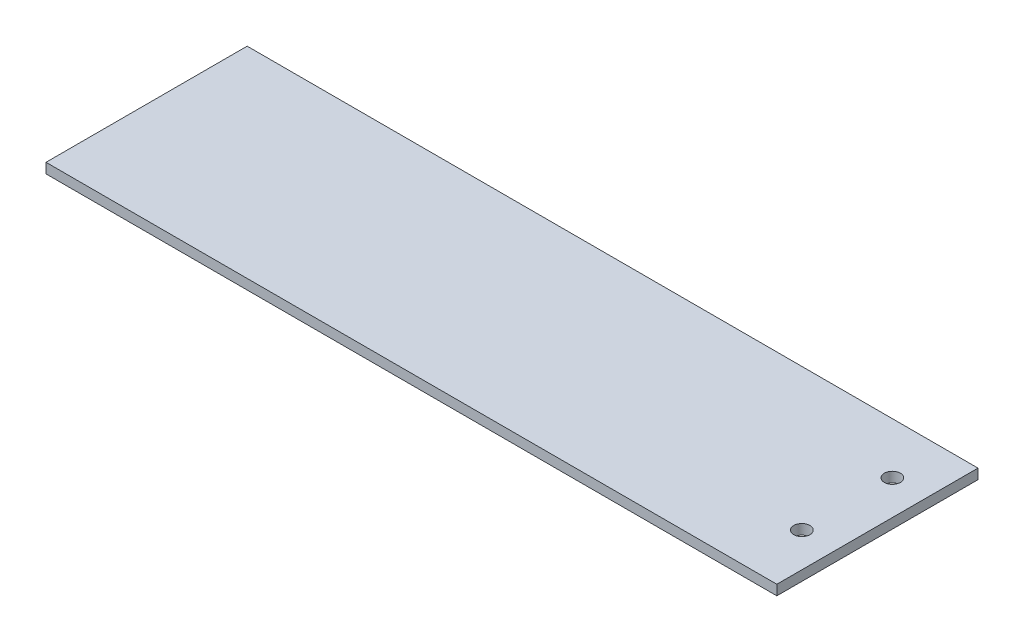
from build123d import *

# Parameters (mm, degrees)
ESBO_O1_W                = 363.3
ESBO_O1_H                = 100
ESBO_O1_R                = 4
RESSALTO_EXTRUS_O1_DEPTH = 5


with BuildPart() as part:
    # Esboço1 → Ressalto-extrusão1 (new body)
    with BuildSketch(Plane(origin=(0, 0, 0), x_dir=(1, 0, 0), z_dir=(0, 1, 0))):
        with Locations((-161.510348512, 0)):
            Rectangle(ESBO_O1_W, ESBO_O1_H)
        with Locations(Location((3.039651488, 24.534626046, 0), (0, 0, 270))):
            Circle(ESBO_O1_R, mode=Mode.SUBTRACT)
        with Locations(Location((3.039651488, -20.465373954, 0), (0, 0, 270))):
            Circle(ESBO_O1_R, mode=Mode.SUBTRACT)
    extrude(amount=RESSALTO_EXTRUS_O1_DEPTH)


solid = part.part
